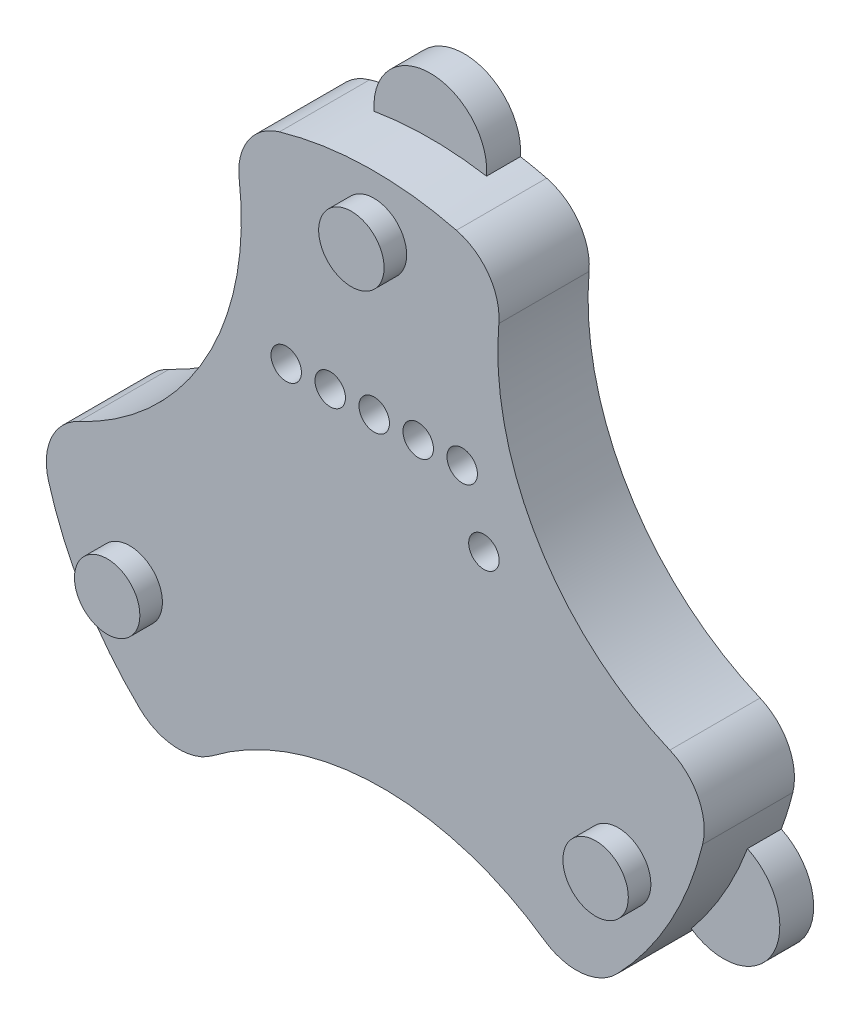
from build123d import *

# Parameters (mm, degrees)
SKETCH2_R           = 18.85
SKETCH2_R_2         = 1.350069841
BOSS_EXTRUDE1_DEPTH = 8
SKETCH3_R           = 30
SKETCH3_R_2         = 17.600030795
BOSS_EXTRUDE2_DEPTH = 8
SKETCH4_R           = 2.9
BOSS_EXTRUDE3_DEPTH = 2
SKETCH6_R           = 5
BOSS_EXTRUDE4_DEPTH = 3
SKETCH5_R           = 3
CUT_EXTRUDE1_DEPTH  = 3
SKETCH7_R           = 25
CUT_EXTRUDE2_DEPTH  = 8
FILLET1_R           = 5


with BuildPart() as part:
    # Sketch2 → Boss-Extrude1 (new body)
    with BuildSketch(Plane.XY.offset(10)):
        Circle(SKETCH2_R)
        with Locations((7.824268806, 11.301452471)):
            Circle(SKETCH2_R_2, mode=Mode.SUBTRACT)
        with Locations((3.924268806, 11.301452471)):
            Circle(SKETCH2_R_2, mode=Mode.SUBTRACT)
        with Locations((0.024268806, 11.301452471)):
            Circle(SKETCH2_R_2, mode=Mode.SUBTRACT)
        with Locations((-3.875731194, 11.301452471)):
            Circle(SKETCH2_R_2, mode=Mode.SUBTRACT)
        with Locations((-7.775731194, 11.301452471)):
            Circle(SKETCH2_R_2, mode=Mode.SUBTRACT)
        with Locations((9.749100056, 5.629684708)):
            Circle(SKETCH2_R_2, mode=Mode.SUBTRACT)
    extrude(amount=BOSS_EXTRUDE1_DEPTH)

    # Sketch3 → Boss-Extrude2 (add)
    with BuildSketch(Plane.XY.offset(18)):
        Circle(SKETCH3_R)
        Circle(SKETCH3_R_2, mode=Mode.SUBTRACT)
    extrude(amount=-BOSS_EXTRUDE2_DEPTH)

    # Sketch4 → Boss-Extrude3 (add)
    with BuildSketch(Plane.XY.offset(18)):
        with Locations((0, 25)):
            Circle(SKETCH4_R)
        with Locations((21.650635095, -12.5)):
            Circle(SKETCH4_R)
        with Locations((-21.650635095, -12.5)):
            Circle(SKETCH4_R)
    extrude(amount=BOSS_EXTRUDE3_DEPTH)

    # Sketch6 → Boss-Extrude4 (add)
    with BuildSketch(Plane(origin=(0, 0, 10), x_dir=(-1, 0, 0), z_dir=(0, 0, -1))):
        with Locations((0, 30)):
            Circle(SKETCH6_R)
        with Locations((25.980762114, -15)):
            Circle(SKETCH6_R)
        with Locations((-25.980762114, -15)):
            Circle(SKETCH6_R)
    extrude(amount=-BOSS_EXTRUDE4_DEPTH)

    # Sketch5 → Cut-Extrude1 (cut)
    with BuildSketch(Plane(origin=(0, 0, 10), x_dir=(-1, 0, 0), z_dir=(0, 0, -1))):
        with Locations((0, 25)):
            Circle(SKETCH5_R)
        with Locations((21.650635095, -12.5)):
            Circle(SKETCH5_R)
        with Locations((-21.650635095, -12.5)):
            Circle(SKETCH5_R)
    extrude(amount=-CUT_EXTRUDE1_DEPTH, mode=Mode.SUBTRACT)

    # Sketch7 → Cut-Extrude2 (cut)
    with BuildSketch(Plane(origin=(0, 0, 10), x_dir=(-1, 0, 0), z_dir=(0, 0, -1))):
        with Locations((-35.980083702, 21.666415873)):
            Circle(SKETCH7_R)
        with Locations((36.753708406, 20.32645858)):
            Circle(SKETCH7_R)
        with Locations((-0.773624703, -41.992874453)):
            Circle(SKETCH7_R)
    extrude(amount=-CUT_EXTRUDE2_DEPTH, mode=Mode.SUBTRACT)

    # Fillet1
    fillet1_edges = [part.edges().sort_by_distance(p)[0] for p in [
        (29.888839754, -2.580166302, 14),
        (11.700383981, 27.624283062, 14),
        (-12.709930313, 27.174577668, 14),
        (-29.773522884, -3.679311769, 14),
        (-17.178909441, -24.594411366, 14),
        (18.073138902, -23.944971293, 14),
    ]]
    fillet(fillet1_edges, radius=FILLET1_R)


solid = part.part
